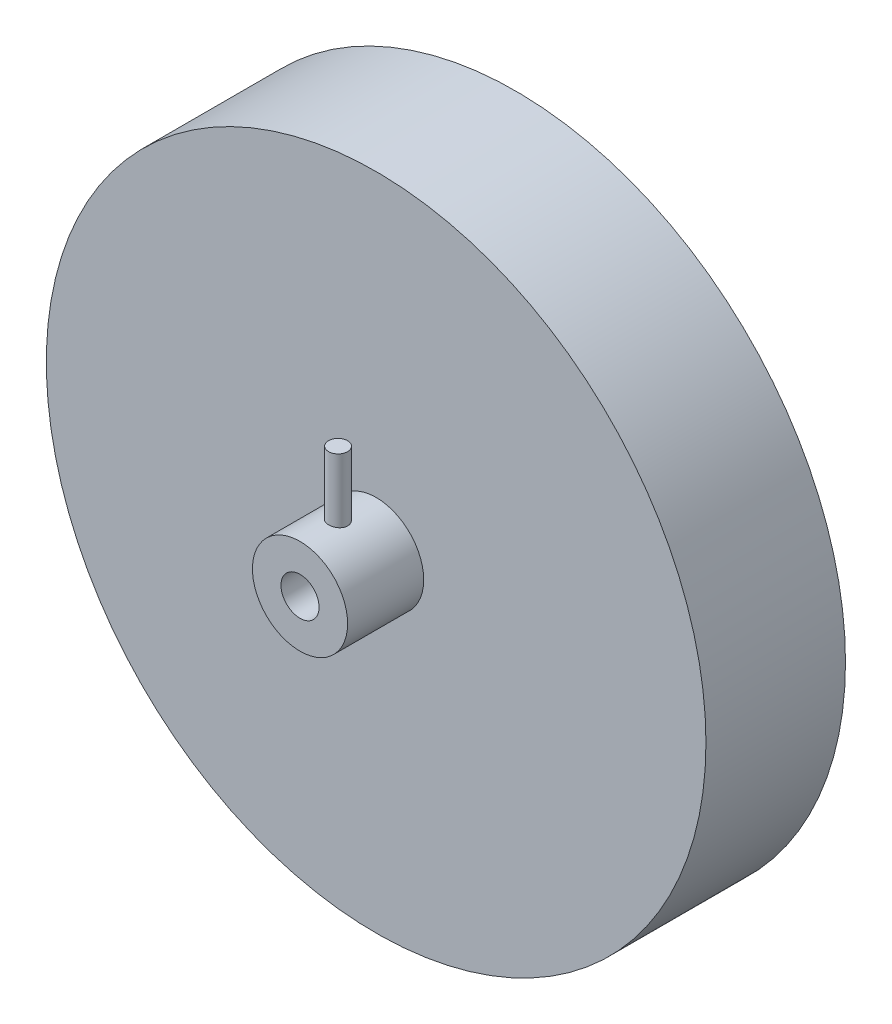
from build123d import *

# Parameters (mm, degrees)
SKETCH1_R           = 52
BOSS_EXTRUDE1_DEPTH = 11
SKETCH2_R           = 7.5
BOSS_EXTRUDE2_DEPTH = 12
SKETCH3_R           = 1.5
BOSS_EXTRUDE3_DEPTH = 17.5
SKETCH4_R           = 3
CUT_EXTRUDE3_DEPTH  = 12


with BuildPart() as part:
    # Sketch1 → Boss-Extrude1 (new, symmetric)
    with BuildSketch(Plane.XY):
        Circle(SKETCH1_R)
    extrude(amount=BOSS_EXTRUDE1_DEPTH, both=True)

    # Sketch2 → Boss-Extrude2 (add)
    with BuildSketch(Plane.XY.offset(11)):
        Circle(SKETCH2_R)
    extrude(amount=BOSS_EXTRUDE2_DEPTH)

    # Sketch3 → Boss-Extrude3 (add)
    with BuildSketch(Plane(origin=(0, 0, 0), x_dir=(1, 0, 0), z_dir=(0, 1, 0))):
        with Locations(Location((0, -17, 0), (0, 0, 90))):
            Circle(SKETCH3_R)
    extrude(amount=BOSS_EXTRUDE3_DEPTH)

    # Sketch4 → Cut-Extrude3 (cut)
    with BuildSketch(Plane(origin=(0, 0, 23), x_dir=(-1, 0, 0), z_dir=(0, 0, -1))):
        Circle(SKETCH4_R)
    extrude(amount=CUT_EXTRUDE3_DEPTH, mode=Mode.SUBTRACT)


solid = part.part
